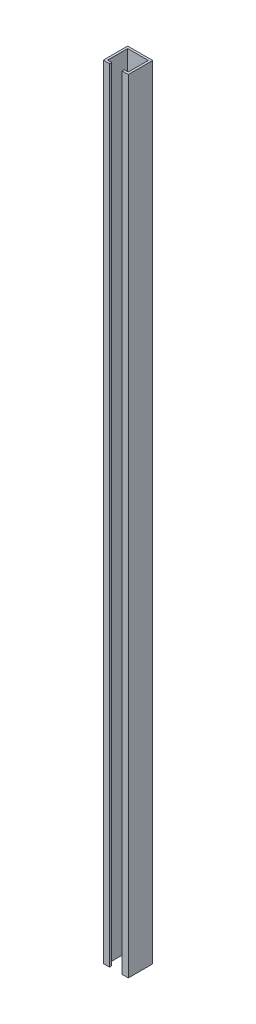
from build123d import *

# Parameters (mm, degrees)
BOSS_EXTRUDE1_DEPTH = 360


with BuildPart() as part:
    # Sketch2 → Boss-Extrude1 (new, symmetric)
    with BuildSketch(Plane(origin=(0, 0, 0), x_dir=(1, 0, 0), z_dir=(0, 1, 0))):
        Polygon((9.5, 2), (5.75, 2), (5.75, 0), (11.5, 0), (11.5, 22.456660903), (-11.5, 22.456660903), (-11.5, 0), (-5.75, 0), (-5.75, 2), (-9.5, 2), (-9.5, 20.456660903), (9.5, 20.456660903), align=None)
    extrude(amount=BOSS_EXTRUDE1_DEPTH, both=True)


solid = part.part
